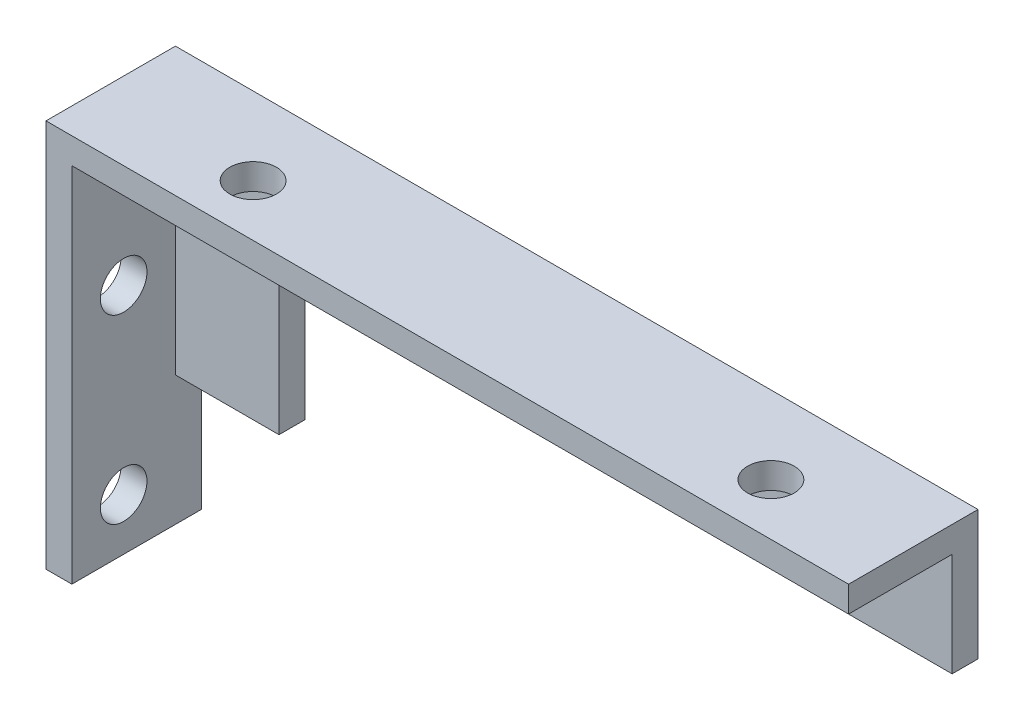
from build123d import *

# Parameters (mm, degrees)
BOSS_EXTRU_1_DEPTH      = 5
ENL_V_MAT_EXTRU_1_DEPTH = 4
ESQUISSE3_R             = 0.9
ENL_V_MAT_EXTRU_2_DEPTH = 10
ESQUISSE4_R             = 0.9
ENL_V_MAT_EXTRU_3_DEPTH = 10


with BuildPart() as part:
    # Esquisse1 → Boss.-Extru.1 (new body)
    with BuildSketch(Plane.XY):
        Polygon((0, 0), (31, 0), (31, -5), (5, -5), (5, -10), (1, -10), (1, -15), (0, -15), align=None)
    extrude(amount=BOSS_EXTRU_1_DEPTH)

    # Esquisse2 → Enlèv. mat.-Extru.1 (cut)
    with BuildSketch(Plane.XY.offset(5)):
        Polygon((1, -10), (1, -1), (31, -1), (31, -5), (5, -5), (5, -10), align=None)
    extrude(amount=-ENL_V_MAT_EXTRU_1_DEPTH, mode=Mode.SUBTRACT)

    # Esquisse3 → Enlèv. mat.-Extru.2 (cut)
    with BuildSketch(Plane(origin=(1, 0, 0), x_dir=(0, 0, -1), z_dir=(1, 0, 0))):
        with Locations((-3, -6)):
            Circle(ESQUISSE3_R)
        with Locations((-3, -13)):
            Circle(ESQUISSE3_R)
    extrude(amount=-ENL_V_MAT_EXTRU_2_DEPTH, mode=Mode.SUBTRACT)

    # Esquisse4 → Enlèv. mat.-Extru.3 (cut)
    with BuildSketch(Plane.XZ.offset(1)):
        with Locations(Location((6, 3, 0), (0, 0, 270))):
            Circle(ESQUISSE4_R)
        with Locations(Location((26, 3, 0), (0, 0, 270))):
            Circle(ESQUISSE4_R)
    extrude(amount=-ENL_V_MAT_EXTRU_3_DEPTH, mode=Mode.SUBTRACT)


solid = part.part
